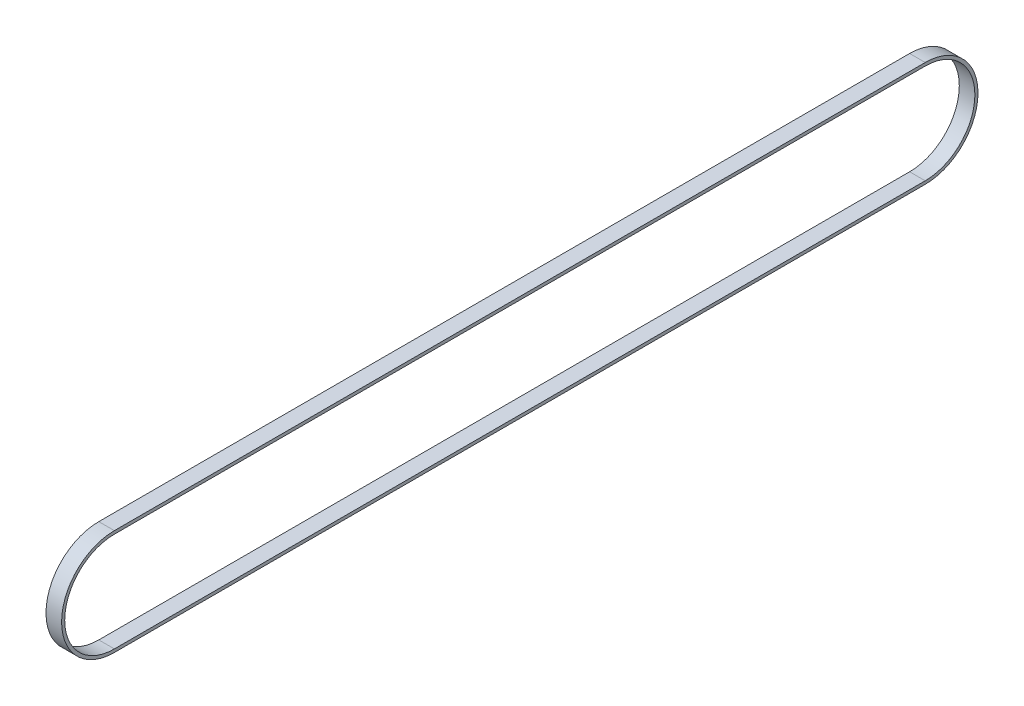
from build123d import *

# Parameters (mm, degrees)
BOSS_EXTRUDE1_DEPTH = 10


with BuildPart() as part:
    # Sketch1 → Boss-Extrude1 (new body)
    with BuildSketch(Plane(origin=(0, 0, 0), x_dir=(0, 0, -1), z_dir=(1, 0, 0))):
        with BuildLine():
            Line((0, -33.85), (520, -33.85))
            ThreePointArc((520, -33.85), (553.85, 0), (520, 33.85))
            Line((520, 33.85), (0, 33.85))
            ThreePointArc((0, 33.85), (-33.85, 0), (0, -33.85))
        make_face()
        with BuildLine():
            Line((520, 31.85), (0, 31.85))
            ThreePointArc((0, 31.85), (-31.85, 0), (0, -31.85))
            Line((0, -31.85), (520, -31.85))
            ThreePointArc((520, -31.85), (551.85, 0), (520, 31.85))
        make_face(mode=Mode.SUBTRACT)
    extrude(amount=BOSS_EXTRUDE1_DEPTH)


solid = part.part
